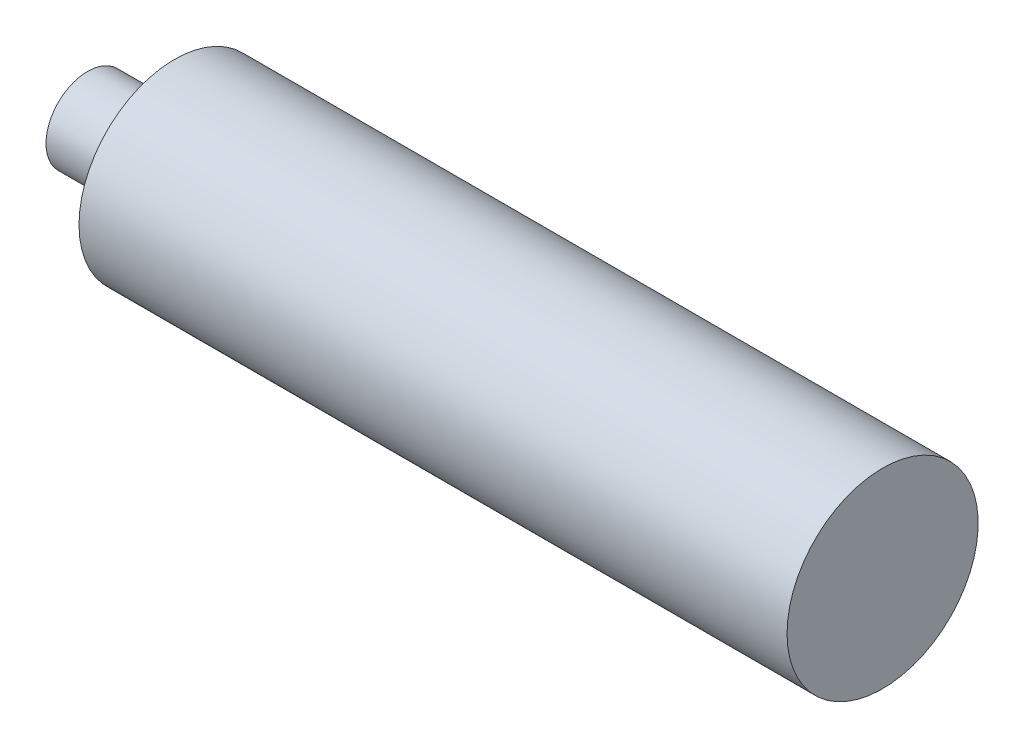
from build123d import *

# Parameters (mm, degrees)
SKETCH1_R           = 11
BOSS_EXTRUDE1_DEPTH = 81.5
SKETCH2_R           = 4.8
BOSS_EXTRUDE2_DEPTH = 10


with BuildPart() as part:
    # Sketch1 → Boss-Extrude1 (new body)
    with BuildSketch(Plane.ZY.offset(304.8)):
        with Locations((-139.7, 32.815)):
            Circle(SKETCH1_R)
    extrude(amount=-BOSS_EXTRUDE1_DEPTH)

    # Sketch2 → Boss-Extrude2 (add)
    with BuildSketch(Plane.ZY.offset(304.8)):
        with Locations((-139.7, 32.815)):
            Circle(SKETCH2_R)
    extrude(amount=BOSS_EXTRUDE2_DEPTH)


solid = part.part
